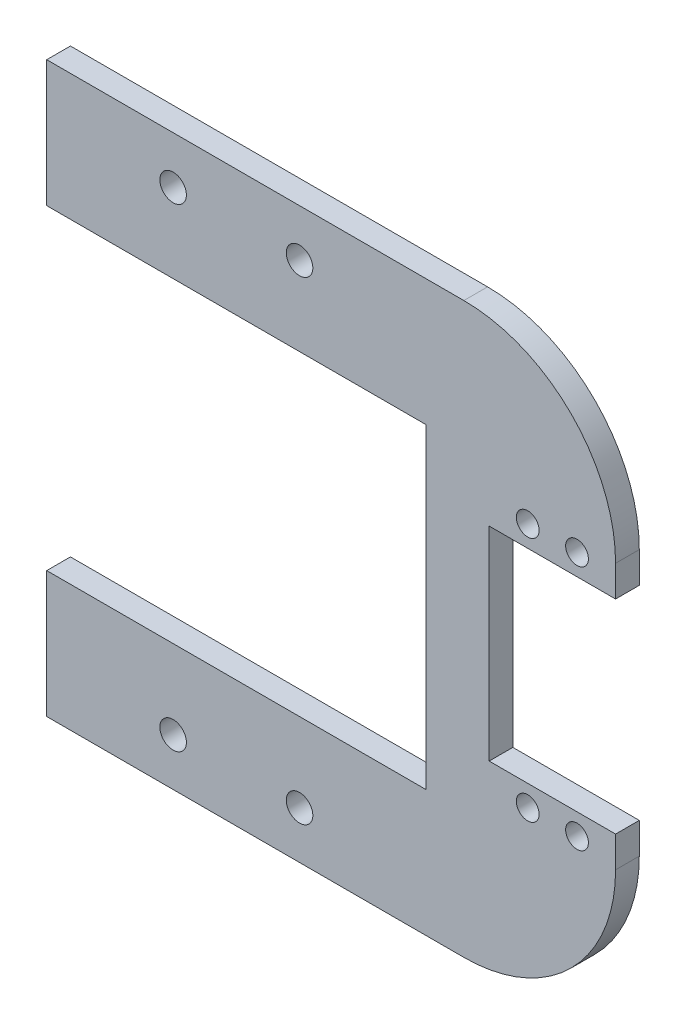
from build123d import *

# Parameters (mm, degrees)
SKETCH1_R           = 2.286
SKETCH1_R_2         = 2.667
BOSS_EXTRUDE1_DEPTH = 4.7625


with BuildPart() as part:
    # Sketch1 → Boss-Extrude1 (new body)
    with BuildSketch(Plane.XY):
        with BuildLine():
            Line((0, 0), (0, 63.5))
            Line((0, 63.5), (-76.2, 63.5))
            Line((-76.2, 63.5), (-76.2, 88.9))
            Line((-76.2, 88.9), (7.62, 88.9))
            ThreePointArc((7.62, 88.9), (29.172614691, 79.972614691), (38.1, 58.42))
            Line((38.1, 58.42), (38.1, 52.197))
            Line((38.1, 52.197), (12.7, 52.197))
            Line((12.7, 52.197), (12.7, 11.303))
            Line((12.7, 11.303), (38.1, 11.303))
            Line((38.1, 11.303), (38.1, 5.08))
            ThreePointArc((38.1, 5.08), (29.172614691, -16.472614691), (7.62, -25.4))
            Line((7.62, -25.4), (-76.2, -25.4))
            Line((-76.2, -25.4), (-76.2, 0))
            Line((-76.2, 0), (0, 0))
        make_face()
        with Locations(Location((20.447, 56.4515, 0), (0, 0, 180))):
            Circle(SKETCH1_R, mode=Mode.SUBTRACT)
        with Locations(Location((30.353, 56.4515, 0), (0, 0, 180))):
            Circle(SKETCH1_R, mode=Mode.SUBTRACT)
        with Locations(Location((20.447, 7.0485, 0), (0, 0, 180))):
            Circle(SKETCH1_R, mode=Mode.SUBTRACT)
        with Locations(Location((30.353, 7.0485, 0), (0, 0, 180))):
            Circle(SKETCH1_R, mode=Mode.SUBTRACT)
        with Locations(Location((-50.8, 79.375, 0), (0, 0, 180))):
            Circle(SKETCH1_R_2, mode=Mode.SUBTRACT)
        with Locations(Location((-25.4, 79.375, 0), (0, 0, 180))):
            Circle(SKETCH1_R_2, mode=Mode.SUBTRACT)
        with Locations(Location((-50.8, -15.875, 0), (0, 0, 180))):
            Circle(SKETCH1_R_2, mode=Mode.SUBTRACT)
        with Locations(Location((-25.4, -15.875, 0), (0, 0, 180))):
            Circle(SKETCH1_R_2, mode=Mode.SUBTRACT)
    extrude(amount=BOSS_EXTRUDE1_DEPTH)


solid = part.part
